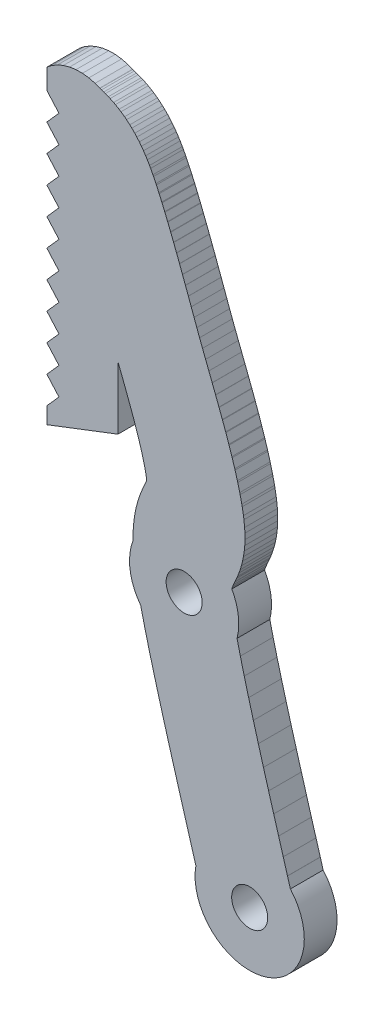
from build123d import *

# Parameters (mm, degrees)
PLASTINA_DEPTH        = 3
OTVERSTIYA_DEPTH      = 94.903762655
OTVERSTIYA_DEPTH_BACK = 94.903762655
ESKIZ_OTVERSTIYA_R    = 1.65


with BuildPart() as part:
    # Eskiz_kontur → Plastina (new body)
    with BuildSketch(Plane.XY):
        with BuildLine():
            Line((6.8, 63.77887), (0.3, 61.27887))
            Line((0.3, 61.27887), (0.3, 62.79013))
            Line((0.3, 62.79013), (1.4, 64.02887))
            Line((1.4, 64.02887), (0.3, 65.26761))
            Line((0.3, 65.26761), (0.3, 65.29013))
            Line((0.3, 65.29013), (1.4, 66.52887))
            Line((1.4, 66.52887), (0.3, 67.76761))
            Line((0.3, 67.76761), (0.3, 67.79013))
            Line((0.3, 67.79013), (1.4, 69.02887))
            Line((1.4, 69.02887), (0.3, 70.26761))
            Line((0.3, 70.26761), (0.3, 70.29013))
            Line((0.3, 70.29013), (1.4, 71.52887))
            Line((1.4, 71.52887), (0.3, 72.76761))
            Line((0.3, 72.76761), (0.3, 72.79013))
            Line((0.3, 72.79013), (1.4, 74.02887))
            Line((1.4, 74.02887), (0.3, 75.26761))
            Line((0.3, 75.26761), (0.3, 75.29013))
            Line((0.3, 75.29013), (1.4, 76.52887))
            Line((1.4, 76.52887), (0.3, 77.76761))
            Line((0.3, 77.76761), (0.3, 77.79013))
            Line((0.3, 77.79013), (1.4, 79.02887))
            Line((1.4, 79.02887), (0.3, 80.26761))
            Line((0.3, 80.26761), (0.3, 80.29013))
            Line((0.3, 80.29013), (1.4, 81.52887))
            Line((1.4, 81.52887), (0.3, 82.76761))
            Line((0.3, 82.76761), (0.3, 82.79013))
            Line((0.3, 82.79013), (1.4, 84.02887))
            Line((1.4, 84.02887), (0.3, 85.26761))
            Line((0.3, 85.26761), (0.3, 85.29013))
            Line((0.3, 85.29013), (1.4, 86.52887))
            Line((1.4, 86.52887), (0.3, 87.76761))
            Line((0.3, 87.76761), (0.3, 89.63274))
            Line((0.3, 89.63274), (0.76115, 89.99428))
            Line((0.76115, 89.99428), (1.26783, 90.29388))
            Line((1.26783, 90.29388), (1.80928, 90.52478))
            Line((1.80928, 90.52478), (2.37624, 90.68304))
            Line((2.37624, 90.68304), (2.959, 90.76593))
            Line((2.959, 90.76593), (3.5476, 90.77205))
            Line((3.5476, 90.77205), (4.13196, 90.7013))
            Line((4.13196, 90.7013), (4.70208, 90.55487))
            Line((4.70208, 90.55487), (5.12916, 90.38315))
            Line((5.12916, 90.38315), (5.15458, 90.37574))
            Line((5.15458, 90.37574), (5.29679, 90.33253))
            Line((5.29679, 90.33253), (5.49831, 90.26607))
            Line((5.49831, 90.26607), (5.6498, 90.21211))
            Line((5.6498, 90.21211), (5.92363, 90.10437))
            Line((5.92363, 90.10437), (6.08366, 90.03528))
            Line((6.08366, 90.03528), (6.40111, 89.88324))
            Line((6.40111, 89.88324), (6.56895, 89.79461))
            Line((6.56895, 89.79461), (6.90272, 89.59961))
            Line((6.90272, 89.59961), (7.07765, 89.48706))
            Line((7.07765, 89.48706), (7.40402, 89.25594))
            Line((7.40402, 89.25594), (7.58529, 89.11507))
            Line((7.58529, 89.11507), (7.88649, 88.85902))
            Line((7.88649, 88.85902), (8.07338, 88.68543))
            Line((8.07338, 88.68543), (8.33884, 88.41729))
            Line((8.33884, 88.41729), (8.53061, 88.20659))
            Line((8.53061, 88.20659), (8.75637, 87.93826))
            Line((8.75637, 87.93826), (8.95229, 87.68606))
            Line((8.95229, 87.68606), (9.13932, 87.42681))
            Line((9.13932, 87.42681), (9.33866, 87.12871))
            Line((9.33866, 87.12871), (9.4908, 86.88466))
            Line((9.4908, 86.88466), (9.69283, 86.53628))
            Line((9.69283, 86.53628), (9.79308, 86.3538))
            Line((9.79308, 86.3538), (10.00177, 85.95218))
            Line((10.00177, 85.95218), (10.05782, 85.84057))
            Line((10.05782, 85.84057), (10.27693, 85.38866))
            Line((10.27693, 85.38866), (10.31757, 85.30253))
            Line((10.31757, 85.30253), (10.54606, 84.80473))
            Line((10.54606, 84.80473), (10.57659, 84.73675))
            Line((10.57659, 84.73675), (10.81339, 84.19744))
            Line((10.81339, 84.19744), (10.83693, 84.14286))
            Line((10.83693, 84.14286), (11.081, 83.56645))
            Line((11.081, 83.56645), (11.09951, 83.52207))
            Line((11.09951, 83.52207), (11.34979, 82.91294))
            Line((11.34979, 82.91294), (11.36456, 82.87654))
            Line((11.36456, 82.87654), (11.62, 82.23909))
            Line((11.62, 82.23909), (11.63189, 82.20912))
            Line((11.63189, 82.20912), (11.89143, 81.54774))
            Line((11.89143, 81.54774), (11.90103, 81.52305))
            Line((11.90103, 81.52305), (12.16362, 80.84214))
            Line((12.16362, 80.84214), (12.17137, 80.82191))
            Line((12.17137, 80.82191), (12.43596, 80.12586))
            Line((12.43596, 80.12586), (12.44214, 80.10949))
            Line((12.44214, 80.10949), (12.70767, 79.4027))
            Line((12.70767, 79.4027), (12.71251, 79.38975))
            Line((12.71251, 79.38975), (12.97793, 78.67662))
            Line((12.97793, 78.67662), (12.98157, 78.6668))
            Line((12.98157, 78.6668), (13.24582, 77.95171))
            Line((13.24582, 77.95171), (13.24835, 77.94483))
            Line((13.24835, 77.94483), (13.51038, 77.23219))
            Line((13.51038, 77.23219), (13.77061, 76.52236))
            Line((13.77061, 76.52236), (14.02145, 75.83756))
            Line((14.02145, 75.83756), (14.27268, 75.16252))
            Line((14.27268, 75.16252), (14.54044, 74.45988))
            Line((14.54044, 74.45988), (14.82531, 73.72311))
            Line((14.82531, 73.72311), (15.1231, 72.95809))
            Line((15.1231, 72.95809), (15.42812, 72.17426))
            Line((15.42812, 72.17426), (15.43191, 72.1645))
            Line((15.43191, 72.1645), (15.73828, 71.37178))
            Line((15.73828, 71.37178), (15.74559, 71.35273))
            Line((15.74559, 71.35273), (16.0497, 70.55512))
            Line((16.0497, 70.55512), (16.0605, 70.52649))
            Line((16.0605, 70.52649), (16.35859, 69.7284))
            Line((16.35859, 69.7284), (16.37292, 69.68951))
            Line((16.37292, 69.68951), (16.66124, 68.89532))
            Line((16.66124, 68.89532), (16.67916, 68.84505))
            Line((16.67916, 68.84505), (16.95397, 68.05916))
            Line((16.95397, 68.05916), (16.97557, 67.99587))
            Line((16.97557, 67.99587), (17.23311, 67.22268))
            Line((17.23311, 67.22268), (17.25849, 67.14407))
            Line((17.25849, 67.14407), (17.49502, 66.38796))
            Line((17.49502, 66.38796), (17.5242, 66.29084))
            Line((17.5242, 66.29084), (17.73595, 65.55622))
            Line((17.73595, 65.55622), (17.76875, 65.4362))
            Line((17.76875, 65.4362), (17.95198, 64.72746))
            Line((17.95198, 64.72746), (17.98781, 64.57843))
            Line((17.98781, 64.57843), (18.13876, 63.89996))
            Line((18.13876, 63.89996), (18.17614, 63.71345))
            Line((18.17614, 63.71345), (18.29106, 63.06965))
            Line((18.29106, 63.06965), (18.33458, 62.76655))
            Line((18.33458, 62.76655), (18.39827, 62.18232))
            Line((18.39827, 62.18232), (18.4245, 61.74426))
            Line((18.4245, 61.74426), (18.43014, 61.23278))
            Line((18.43014, 61.23278), (18.40964, 60.75125))
            Line((18.40964, 60.75125), (18.36606, 60.29934))
            Line((18.36606, 60.29934), (18.29339, 59.81893))
            Line((18.29339, 59.81893), (18.20943, 59.41342))
            Line((18.20943, 59.41342), (18.1008, 58.99236))
            Line((18.1008, 58.99236), (17.98529, 58.62005))
            Line((17.98529, 58.62005), (17.87649, 58.30986))
            Line((17.87649, 58.30986), (17.73827, 57.95756))
            Line((17.73827, 57.95756), (17.66763, 57.78782))
            Line((17.66763, 57.78782), (17.51553, 57.44236))
            Line((17.51553, 57.44236), (17.50577, 57.42035))
            Line((17.50577, 57.42035), (17.37472, 57.12697))
            Line((17.37472, 57.12697), (17.29431, 56.93227))
            Line((17.29431, 56.93227), (17.25168, 56.80989))
            Line((17.25168, 56.80989), (17.22683, 56.71614))
            ThreePointArc((17.22683, 56.71614), (17.81905374, 54.925836346), (17.706072328, 53.043510304))
            Line((17.706072328, 53.043510304), (18.007482328, 51.784760304))
            Line((18.007482328, 51.784760304), (18.364892328, 50.379560304))
            Line((18.364892328, 50.379560304), (18.765342328, 48.871020304))
            Line((18.765342328, 48.871020304), (19.198542328, 47.289600304))
            Line((19.198542328, 47.289600304), (19.654492328, 45.664110304))
            Line((19.654492328, 45.664110304), (20.123352328, 44.022450304))
            Line((20.123352328, 44.022450304), (20.595392328, 42.391910304))
            Line((20.595392328, 42.391910304), (21.061012328, 40.799310304))
            Line((21.061012328, 40.799310304), (21.510692328, 39.271120304))
            Line((21.510692328, 39.271120304), (21.934862328, 37.833890304))
            Line((21.934862328, 37.833890304), (22.323762328, 36.514830304))
            Line((22.323762328, 36.514830304), (22.325932328, 36.507440304))
            Line((22.325932328, 36.507440304), (22.588382328, 35.611630304))
            ThreePointArc((22.588382328, 35.611630304), (20.236086357, 27.471646602), (13.93520145, 33.136580881))
            Line((13.93520145, 33.136580881), (13.69005145, 33.973360881))
            Line((13.69005145, 33.973360881), (13.30276145, 35.286940881))
            Line((13.30276145, 35.286940881), (12.87826145, 36.725310881))
            Line((12.87826145, 36.725310881), (12.42594145, 38.262490881))
            Line((12.42594145, 38.262490881), (12.42373145, 38.270000881))
            Line((12.42373145, 38.270000881), (11.95535145, 39.872050881))
            Line((11.95535145, 39.872050881), (11.95203145, 39.883460881))
            Line((11.95203145, 39.883460881), (11.47608145, 41.527500881))
            Line((11.47608145, 41.527500881), (11.47160145, 41.543090881))
            Line((11.47160145, 41.543090881), (10.99760145, 43.202760881))
            Line((10.99760145, 43.202760881), (10.99181145, 43.223190881))
            Line((10.99181145, 43.223190881), (10.52929145, 44.872120881))
            Line((10.52929145, 44.872120881), (10.52196145, 44.898570881))
            Line((10.52196145, 44.898570881), (10.08043145, 46.510390881))
            Line((10.08043145, 46.510390881), (10.07116145, 46.544730881))
            Line((10.07116145, 46.544730881), (9.66015145, 48.093070881))
            Line((9.66015145, 48.093070881), (9.64838145, 48.138360881))
            Line((9.64838145, 48.138360881), (9.27741145, 49.596850881))
            Line((9.27741145, 49.596850881), (9.26226145, 49.658210881))
            Line((9.26226145, 49.658210881), (8.94085145, 51.000500881))
            Line((8.94085145, 51.000500881), (8.92101145, 51.087140881))
            Line((8.92101145, 51.087140881), (8.88640145, 51.245410881))
            ThreePointArc((8.88640145, 51.245410881), (7.913326777, 53.557993394), (8.18608, 56.05209))
            Line((8.18608, 56.05209), (8.18766, 56.60115))
            Line((8.18766, 56.60115), (8.20411, 56.97289))
            Line((8.20411, 56.97289), (8.25399, 57.55418))
            Line((8.25399, 57.55418), (8.30476, 57.94451))
            Line((8.30476, 57.94451), (8.39376, 58.45354))
            Line((8.39376, 58.45354), (8.47678, 58.83168))
            Line((8.47678, 58.83168), (8.59606, 59.28164))
            Line((8.59606, 59.28164), (8.69622, 59.60871))
            Line((8.69622, 59.60871), (8.83696, 60.01276))
            Line((8.83696, 60.01276), (8.9273, 60.25029))
            Line((8.9273, 60.25029), (9.08066, 60.62163))
            Line((9.08066, 60.62163), (9.13118, 60.73919))
            Line((9.13118, 60.73919), (9.28342, 61.08001))
            Line((9.28342, 61.08001), (9.39362, 61.3303))
            Line((9.39362, 61.3303), (9.42757, 61.41681))
            Line((9.42757, 61.41681), (9.42747, 61.42536))
            Line((9.42747, 61.42536), (9.40419, 61.6389))
            Line((9.40419, 61.6389), (9.33291, 62.03824))
            Line((9.33291, 62.03824), (9.21926, 62.54903))
            Line((9.21926, 62.54903), (9.0708, 63.12332))
            Line((9.0708, 63.12332), (8.89033, 63.74942))
            Line((8.89033, 63.74942), (8.68128, 64.41771))
            Line((8.68128, 64.41771), (8.44736, 65.11999))
            Line((8.44736, 65.11999), (8.19239, 65.84913))
            Line((8.19239, 65.84913), (7.92024, 66.59876))
            Line((7.92024, 66.59876), (7.63475, 67.36311))
            Line((7.63475, 67.36311), (7.33973, 68.13688))
            Line((7.33973, 68.13688), (7.03893, 68.91521))
            Line((7.03893, 68.91521), (6.8, 69.52918))
            Line((6.8, 69.52918), (6.8, 63.77887))
        make_face()
    extrude(amount=PLASTINA_DEPTH)

    # Eskiz_otverstiya → Otverstiya (cut, two sides: drawn at the far end of the back side and taken through both)
    with BuildSketch(Plane.XY.offset(-OTVERSTIYA_DEPTH_BACK)):
        with Locations((18.86109, 32.27887)):
            Circle(ESKIZ_OTVERSTIYA_R)
        with Locations((12.86109, 54.27887)):
            Circle(ESKIZ_OTVERSTIYA_R)
    extrude(amount=OTVERSTIYA_DEPTH + OTVERSTIYA_DEPTH_BACK, mode=Mode.SUBTRACT)


solid = part.part
